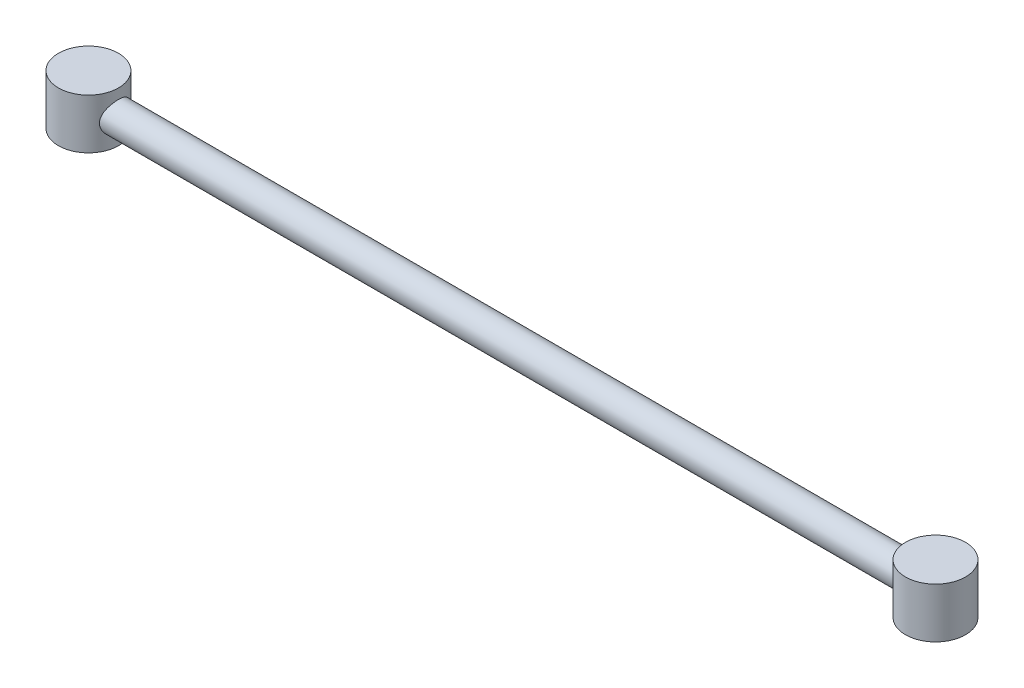
from build123d import *

# Parameters (mm, degrees)
SKETCH1_R                = 19.05
BOSS_EXTRUDE1_DEPTH      = 15.875
BOSS_EXTRUDE2_REACH      = 290.595
BOSS_EXTRUDE2_END_RADIUS = 19.05
SKETCH3_R                = 9.525
SKETCH5_W                = 13.407996618
SKETCH5_H                = 2.54
CUT_EXTRUDE2_DEPTH       = 3.175
BOSS_EXTRUDE3_REACH      = 290.668
SKETCH6_R                = 1.27


with BuildPart() as part:
    # Sketch1 → Boss-Extrude1 (new, symmetric)
    with BuildSketch(Plane(origin=(0, 0, 0), x_dir=(1, 0, 0), z_dir=(0, 1, 0))):
        with Locations(Location((-268.478, 0, 0), (0, 0, 270))):
            Circle(SKETCH1_R)
    extrude(amount=BOSS_EXTRUDE1_DEPTH, both=True)

    # Boss-Extrude2: up to this cylinder (the profile starts outside it)
    boss_extrude2_end = Plane(origin=(-268.478, 0, 0), z_dir=(0, -1, 0)) * Cylinder(BOSS_EXTRUDE2_END_RADIUS, 620.29, mode=Mode.PRIVATE)
    # Sketch3 → Boss-Extrude2 (add, up to the surface)
    with BuildSketch(Plane(origin=(0, 0, 0), x_dir=(0, 0, -1), z_dir=(1, 0, 0)), mode=Mode.PRIVATE) as boss_extrude2_sk1:
        Circle(SKETCH3_R)
    boss_extrude2_tool1 = extrude(boss_extrude2_sk1.sketch, amount=-BOSS_EXTRUDE2_REACH, mode=Mode.PRIVATE) - boss_extrude2_end
    add(boss_extrude2_tool1.solids().sort_by_distance((0, 0, 0))[0])

    # Mirror3: part across plane


with BuildPart() as part_1:
    add(part.part)
    add(part.part.mirror(Plane(origin=(0, 0, 0), x_dir=(0, 0, 1), z_dir=(1, 0, 0))))

    # Sketch4 → Cut-Revolve1 (revolve, cut)
    with BuildSketch(Plane.XZ.offset(15.875)):
        with BuildLine():
            Line((-281.178, 0), (-255.778, 0))
            ThreePointArc((-255.778, 0), (-268.478, 12.7), (-281.178, 0))
        make_face()
        with BuildLine():
            Line((255.778, 0), (281.178, 0))
            ThreePointArc((281.178, 0), (268.478, 12.7), (255.778, 0))
        make_face()
    revolve(axis=Axis((-37.36850349, -15.875, 0), (1, 0, 0)), mode=Mode.SUBTRACT)

    # Sketch5 → Cut-Extrude2 (cut, symmetric)
    with BuildSketch(Plane(origin=(0, 0, 0), x_dir=(0, 0, -1), z_dir=(1, 0, 0))):
        with Locations((6.703998309, 0)):
            Rectangle(SKETCH5_W, SKETCH5_H)
    extrude(amount=CUT_EXTRUDE2_DEPTH, both=True, mode=Mode.SUBTRACT)

    # Sketch6 → Boss-Extrude3 (add, up to next)
    with BuildSketch(Plane(origin=(0, -1.27, 0), x_dir=(1, 0, 0), z_dir=(0, 1, 0)), mode=Mode.PRIVATE) as boss_extrude3_sk1:
        with Locations(Location((0, 6.291669235, 0), (0, 0, 90))):
            Circle(SKETCH6_R)
    boss_extrude3_tool1 = extrude(boss_extrude3_sk1.sketch, amount=BOSS_EXTRUDE3_REACH, mode=Mode.PRIVATE) - part_1.part
    add(boss_extrude3_tool1.solids().sort_by_distance((0, -1.27, -6.291669))[0])


solid = part_1.part
